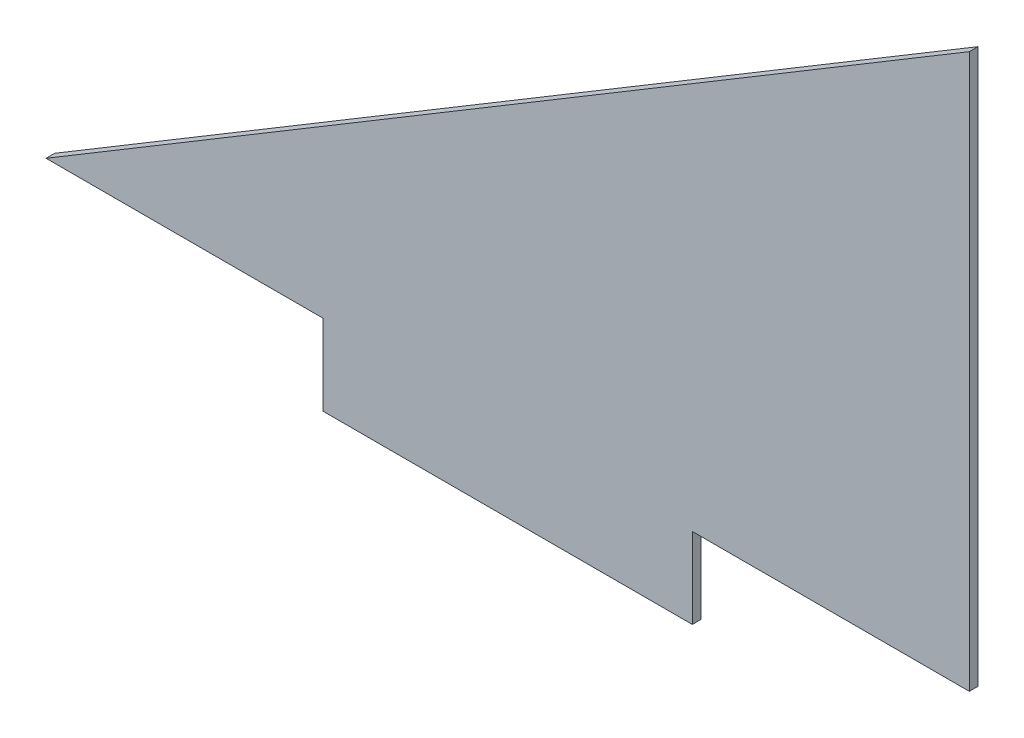
from build123d import *

# Parameters (mm, degrees)
BOSS_EXTRUDE1_DEPTH = 2.3876


with BuildPart() as part:
    # Sketch1 → Boss-Extrude1 (new body)
    with BuildSketch(Plane.XY):
        Polygon((0, 0), (-76.2, 0), (-76.2, -22.1615), (-177.8, -22.1615), (-177.8, 0), (-254, 0), (0, 152.4), align=None)
    extrude(amount=BOSS_EXTRUDE1_DEPTH)


solid = part.part
